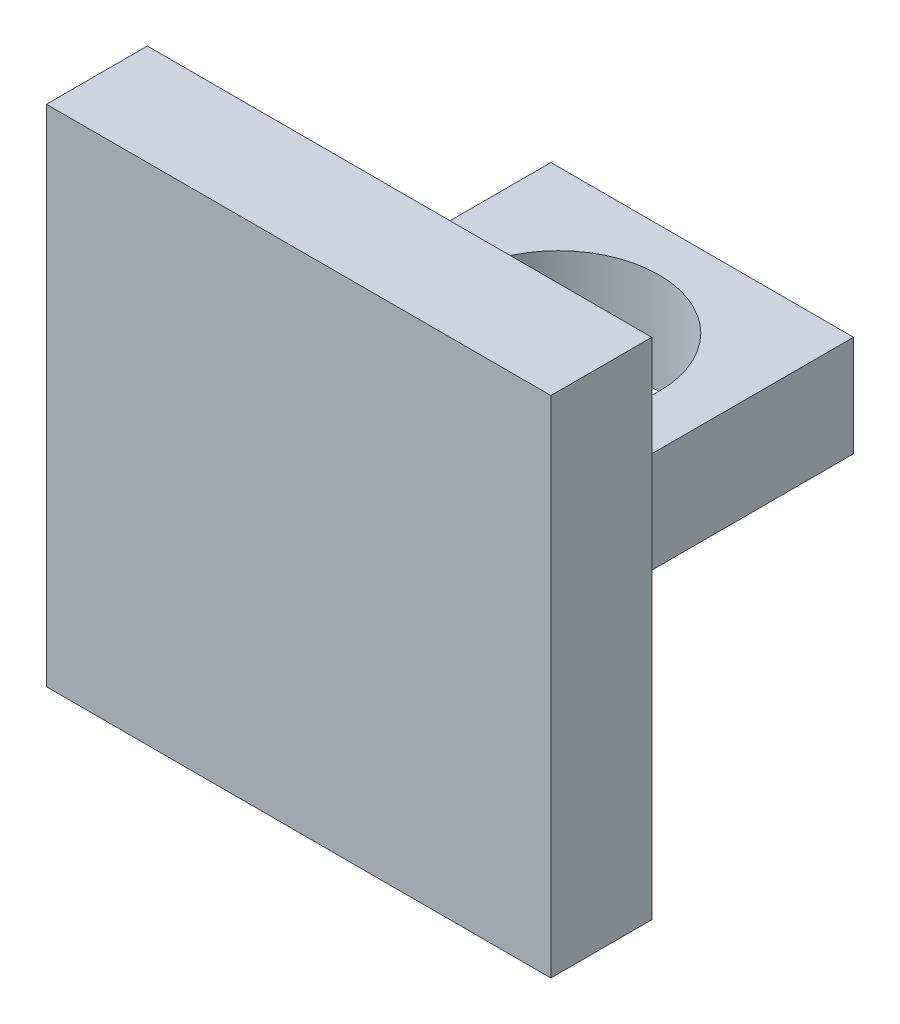
from build123d import *

# Parameters (mm, degrees)
SKETCH_1_W          = 50
SKETCH_1_H          = 50
EXTRUDE_1_DEPTH     = 10
SKETCH_2_W          = 30
SKETCH_2_H          = 10
EXTRUDE_2_DEPTH     = 30
SKETCH_3_R          = 10
CUT_EXTRUDE_1_DEPTH = 30


with BuildPart() as part:
    # 草图1 → 凸台-拉伸1 (new body)
    with BuildSketch(Plane.XY):
        Rectangle(SKETCH_1_W, SKETCH_1_H)
    extrude(amount=EXTRUDE_1_DEPTH)

    # 草图2 → 凸台-拉伸2 (add)
    with BuildSketch(Plane(origin=(0, 0, 0), x_dir=(-1, 0, 0), z_dir=(0, 0, -1))):
        Rectangle(SKETCH_2_W, SKETCH_2_H)
    extrude(amount=EXTRUDE_2_DEPTH)

    # 草图3 → 切除-拉伸1 (cut)
    with BuildSketch(Plane(origin=(0, 5, 0), x_dir=(1, 0, 0), z_dir=(0, 1, 0))):
        with Locations(Location((0, 15.717133963, 0), (0, 0, 180))):
            Circle(SKETCH_3_R)
    extrude(amount=-CUT_EXTRUDE_1_DEPTH, mode=Mode.SUBTRACT)


solid = part.part
